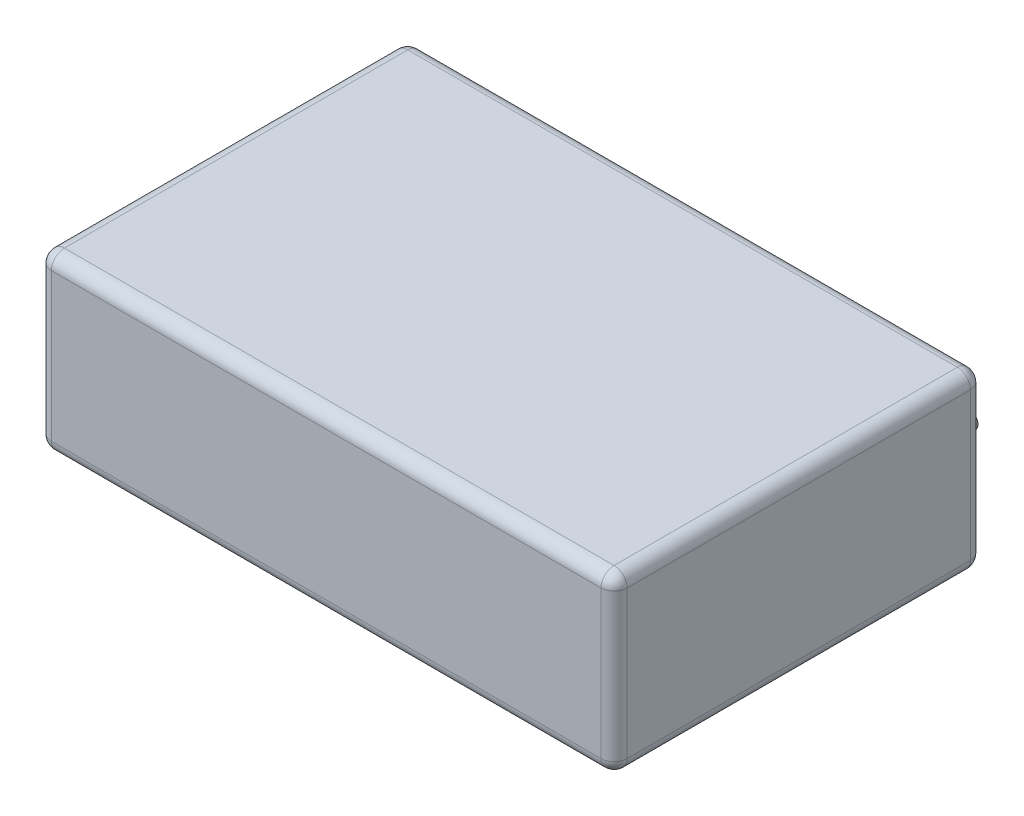
from build123d import *

# Parameters (mm, degrees)
SKETCH_1_W      = 26.5
SKETCH_1_H      = 8
EXTRUDE_1_DEPTH = 17
FILLET_1_R      = 0.6
SKETCH_2_R      = 0.4
EXTRUDE_2_DEPTH = 1.6


with BuildPart() as part:
    # 草图1 → 凸台-拉伸1 (new body)
    with BuildSketch(Plane.XY):
        Rectangle(SKETCH_1_W, SKETCH_1_H)
    extrude(amount=EXTRUDE_1_DEPTH)

    # 圆角1
    fillet_1_edges = [part.edges().sort_by_distance(p)[0] for p in [
        (0, 4, 17),
        (-13.25, 0, 17),
        (0, -4, 17),
        (-13.25, 0, 0),
        (0, 4, 0),
        (13.25, 0, 0),
        (0, -4, 0),
        (13.25, 0, 17),
        (-13.25, -4, 8.5),
        (-13.25, 4, 8.5),
        (13.25, 4, 8.5),
        (13.25, -4, 8.5),
    ]]
    fillet(fillet_1_edges, radius=FILLET_1_R)

    # 草图2 → 凸台-拉伸2 (add)
    with BuildSketch(Plane(origin=(0, 0, 0), x_dir=(-1, 0, 0), z_dir=(0, 0, -1))):
        with Locations(Location((11, 0, 0), (0, 0, 180))):
            Circle(SKETCH_2_R)
        with Locations(Location((-11, 0, 0), (0, 0, 180))):
            Circle(SKETCH_2_R)
    extrude(amount=EXTRUDE_2_DEPTH)


solid = part.part
